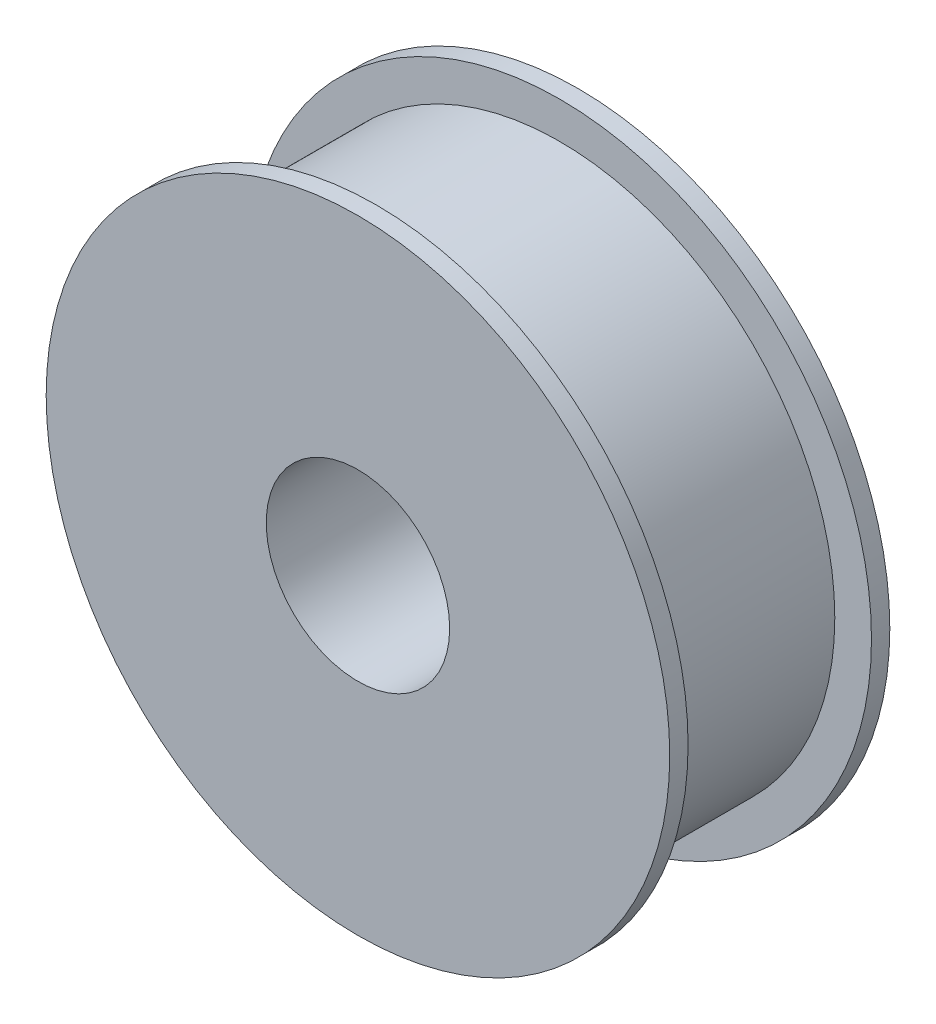
from build123d import *

# Parameters (mm, degrees)
CUT_EXTRUDE1_DEPTH      = 25.779023387
CUT_EXTRUDE1_DEPTH_BACK = 25.779023387
SKETCH3_R               = 5


with BuildPart() as part:
    # Sketch1 → Revolve1 (revolve)
    with BuildSketch(Plane(origin=(0, 0, 0), x_dir=(0, 0, -1), z_dir=(1, 0, 0)), mode=Mode.PRIVATE) as revolve1_sk:
        Polygon((-5, 17), (-5, 15), (5, 15), (5, 17), (6, 17), (6, 0), (-6, 0), (-6, 17), align=None)
    revolve(revolve1_sk.sketch.rotate(Axis((0, 0, 6), (0, 0, -1)), 90), axis=Axis((0, 0, 6), (0, 0, -1)))

    # Sketch3 → Cut-Extrude1 (cut, two sides: drawn at the far end of the back side and taken through both)
    with BuildSketch(Plane.XY.offset(-CUT_EXTRUDE1_DEPTH_BACK)):
        Circle(SKETCH3_R)
    extrude(amount=CUT_EXTRUDE1_DEPTH + CUT_EXTRUDE1_DEPTH_BACK, mode=Mode.SUBTRACT)


solid = part.part
